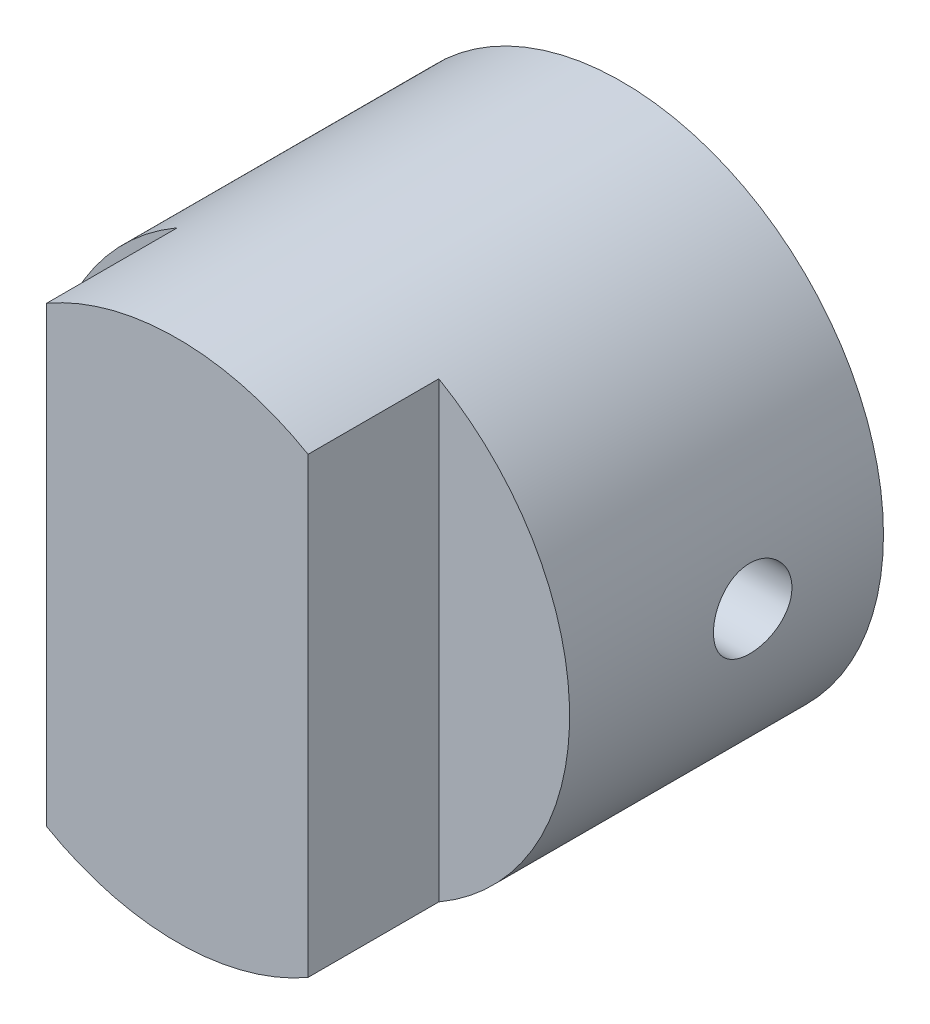
from build123d import *

# Parameters (mm, degrees)
ESBO_O1_R                  = 10
RESSALTO_EXTRUS_O1_DEPTH   = 17
ESBO_O4_R                  = 7.5
CORTE_EXTRUS_O3_DEPTH      = 10
CORTE_EXTRUS_O1_START      = -5
CORTE_EXTRUS_O1_DEPTH      = 5
CORTE_EXTRUS_O4_REACH      = 26.779
CORTE_EXTRUS_O4_END_RADIUS = 10
ESBO_O5_R                  = 1.5


with BuildPart() as part:
    # Esboço1 → Ressalto-extrusão1 (new body)
    with BuildSketch(Plane.XY):
        Circle(ESBO_O1_R)
    extrude(amount=RESSALTO_EXTRUS_O1_DEPTH)

    # Esboço4 → Corte-extrusão3 (cut)
    with BuildSketch(Plane(origin=(0, 0, 0), x_dir=(-1, 0, 0), z_dir=(0, 0, -1))):
        Circle(ESBO_O4_R)
    extrude(amount=-CORTE_EXTRUS_O3_DEPTH, mode=Mode.SUBTRACT)

    # Esboço2 → Corte-extrusão1 (cut)
    with BuildSketch(Plane.XY.offset(17).offset(CORTE_EXTRUS_O1_START)):
        with BuildLine():
            Line((-5, 8.660254038), (-5, -8.660254038))
            ThreePointArc((-5, -8.660254038), (-10, 0), (-5, 8.660254038))
        make_face()
        with BuildLine():
            Line((5, 8.660254038), (5, -8.660254038))
            ThreePointArc((5, -8.660254038), (10, 0), (5, 8.660254038))
        make_face()
    extrude(amount=CORTE_EXTRUS_O1_DEPTH, mode=Mode.SUBTRACT)

    # Corte-extrusão4: up to this cylinder (the profile starts inside it)
    corte_extrus_o4_end = Plane(origin=(0, 0, 5), z_dir=(0, 0, -1)) * Cylinder(CORTE_EXTRUS_O4_END_RADIUS, 74.558, mode=Mode.PRIVATE)
    # Esboço5 → Corte-extrusão4 (cut, up to the surface)
    with BuildSketch(Plane(origin=(5, 0, 0), x_dir=(0, 0, -1), z_dir=(1, 0, 0)), mode=Mode.PRIVATE) as corte_extrus_o4_sk1:
        with Locations(Location((-5, 0, 0), (0, 0, 270))):
            Circle(ESBO_O5_R)
    corte_extrus_o4_tool1 = extrude(corte_extrus_o4_sk1.sketch, amount=CORTE_EXTRUS_O4_REACH, mode=Mode.PRIVATE) & corte_extrus_o4_end
    add(corte_extrus_o4_tool1.solids().sort_by_distance((5, 0, 5))[0], mode=Mode.SUBTRACT)


solid = part.part
